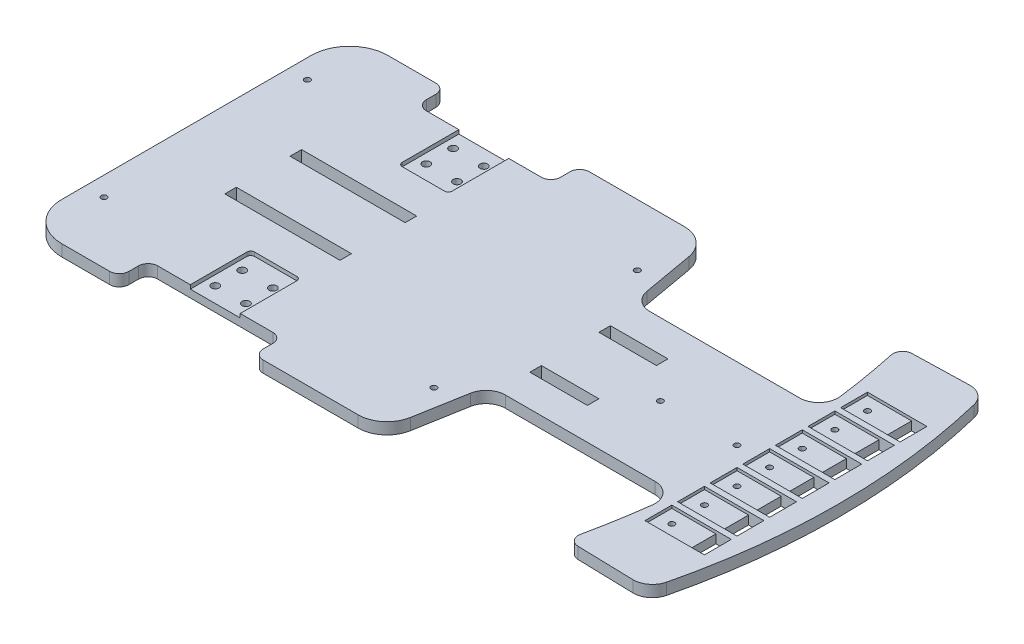
from build123d import *

# Parameters (mm, degrees)
BOSS_EXTRUDE1_DEPTH      = 5
BOSS_EXTRUDE1_DEPTH_BACK = 1
SKETCH1_R                = 2
SKETCH3_R                = 1.5
SKETCH3_W                = 8
SKETCH3_H                = 14
SKETCH3_W_2              = 60
SKETCH3_H_2              = 6
SKETCH3_W_3              = 30
CUT_EXTRUDE2_DEPTH       = 382.529815349
FILLET1_R                = 5
FILLET2_R                = 10
FILLET3_R                = 5
FILLET4_R                = 10
FILLET5_R                = 5
FILLET6_R                = 5
FILLET7_R                = 5
FILLET8_R                = 5
FILLET9_R                = 5
FILLET10_R               = 5
FILLET11_R               = 5
FILLET12_R               = 5
CUT_EXTRUDE3_DEPTH       = 2
SKETCH5_W                = 23
SKETCH5_H                = 14
CUT_EXTRUDE4_DEPTH       = 1.5


with BuildPart() as part:
    # Sketch1 → Boss-Extrude1 (new, two sides: drawn at the far end of the back side and taken through both)
    with BuildSketch(Plane(origin=(0, 0, 0), x_dir=(1, 0, 0), z_dir=(0, 1, 0)).offset(-BOSS_EXTRUDE1_DEPTH_BACK)):
        with BuildLine():
            ThreePointArc((0, 20), (5.857864376, 5.857864376), (20, 0))
            Line((20, 0), (50, 0))
            Line((50, 0), (50, 15))
            Line((50, 15), (120, 15))
            Line((120, 15), (120, 0))
            Line((120, 0), (174.516287626, 0))
            ThreePointArc((174.516287626, 0), (184.152968357, 3.50502786), (189.286071162, 12.382082068))
            Line((189.286071162, 12.382082068), (194.016707233, 39.071410209))
            ThreePointArc((194.016707233, 39.071410209), (197.438775769, 44.989446348), (203.86322959, 47.326131588))
            Line((203.86322959, 47.326131588), (275.479841954, 47.326131588))
            Line((275.479841954, 47.326131588), (281.957258661, 47.326131588))
            ThreePointArc((281.957258661, 47.326131588), (289.464356355, 43.932453122), (291.876118892, 36.05482843))
            ThreePointArc((291.876118892, 36.05482843), (289.726144633, 21.493661084), (287.021151563, 7.025316456))
            ThreePointArc((287.021151563, 7.025316456), (286.072411794, 2.570993654), (285.071048277, -1.871794872))
            Line((285.071048277, -1.871794872), (328.414372402, -3))
            ThreePointArc((328.414372402, -3), (329.306211212, 0.398467763), (330.162883312, 3.805970149))
            ThreePointArc((330.162883312, 3.805970149), (340, 85), (330.162883312, 166.194029851))
            ThreePointArc((330.162883312, 166.194029851), (329.306211212, 169.601532237), (328.414372402, 173))
            Line((328.414372402, 173), (285.071048277, 171.871794872))
            ThreePointArc((285.071048277, 171.871794872), (286.072411794, 167.429006346), (287.021151563, 162.974683544))
            ThreePointArc((287.021151563, 162.974683544), (289.726144633, 148.506338916), (291.876118892, 133.94517157))
            ThreePointArc((291.876118892, 133.94517157), (289.464356355, 126.067546878), (281.957258661, 122.673868412))
            Line((281.957258661, 122.673868412), (275.479841954, 122.673868412))
            Line((275.479841954, 122.673868412), (203.86322959, 122.673868412))
            ThreePointArc((203.86322959, 122.673868412), (197.438775769, 125.010553652), (194.016707233, 130.928589791))
            Line((194.016707233, 130.928589791), (189.286071162, 157.617917932))
            ThreePointArc((189.286071162, 157.617917932), (184.152968357, 166.49497214), (174.516287626, 170))
            Line((174.516287626, 170), (120, 170))
            Line((120, 170), (120, 155))
            Line((120, 155), (50, 155))
            Line((50, 155), (50, 170))
            Line((50, 170), (20, 170))
            ThreePointArc((20, 170), (5.857864376, 164.142135624), (0, 150))
            Line((0, 150), (0, 85))
            Line((0, 85), (0, 20))
        make_face()
        with Locations(Location((77, 23, 0), (0, 0, 270))):
            Circle(SKETCH1_R, mode=Mode.SUBTRACT)
        with Locations(Location((77, 37, 0), (0, 0, 270))):
            Circle(SKETCH1_R, mode=Mode.SUBTRACT)
        with Locations(Location((93, 23, 0), (0, 0, 270))):
            Circle(SKETCH1_R, mode=Mode.SUBTRACT)
        with Locations(Location((93, 37, 0), (0, 0, 270))):
            Circle(SKETCH1_R, mode=Mode.SUBTRACT)
        with Locations(Location((77, 133, 0), (0, 0, 270))):
            Circle(SKETCH1_R, mode=Mode.SUBTRACT)
        with Locations(Location((77, 147, 0), (0, 0, 270))):
            Circle(SKETCH1_R, mode=Mode.SUBTRACT)
        with Locations(Location((93, 133, 0), (0, 0, 270))):
            Circle(SKETCH1_R, mode=Mode.SUBTRACT)
        with Locations(Location((93, 147, 0), (0, 0, 270))):
            Circle(SKETCH1_R, mode=Mode.SUBTRACT)
    extrude(amount=BOSS_EXTRUDE1_DEPTH + BOSS_EXTRUDE1_DEPTH_BACK)

    # Sketch3 → Cut-Extrude2 (cut, through all)
    with BuildSketch(Plane(origin=(0, 5, 0), x_dir=(1, 0, 0), z_dir=(0, 1, 0))):
        with Locations(Location((304, 34, 0), (0, 0, 270))):
            Circle(SKETCH3_R)
        with Locations(Location((304, 51, 0), (0, 0, 270))):
            Circle(SKETCH3_R)
        with Locations((324, 51)):
            Rectangle(SKETCH3_W, SKETCH3_H)
        with Locations((324, 34)):
            Rectangle(SKETCH3_W, SKETCH3_H)
        with Locations(Location((304, 68, 0), (0, 0, 270))):
            Circle(SKETCH3_R)
        with Locations(Location((304, 85, 0), (0, 0, 270))):
            Circle(SKETCH3_R)
        with Locations(Location((304, 102, 0), (0, 0, 270))):
            Circle(SKETCH3_R)
        with Locations((324, 102)):
            Rectangle(SKETCH3_W, SKETCH3_H)
        with Locations((324, 119)):
            Rectangle(SKETCH3_W, SKETCH3_H)
        with Locations((324, 85)):
            Rectangle(SKETCH3_W, SKETCH3_H)
        with Locations((324, 68)):
            Rectangle(SKETCH3_W, SKETCH3_H)
        with Locations((324, 136)):
            Rectangle(SKETCH3_W, SKETCH3_H)
        with Locations(Location((304, 136, 0), (0, 0, 270))):
            Circle(SKETCH3_R)
        with Locations(Location((304, 119, 0), (0, 0, 270))):
            Circle(SKETCH3_R)
        with Locations(Location((247, 85, 0), (0, 0, 270))):
            Circle(SKETCH3_R)
        with Locations(Location((287, 85, 0), (0, 0, 270))):
            Circle(SKETCH3_R)
        with Locations((70, 68)):
            Rectangle(SKETCH3_W_2, SKETCH3_H_2)
        with Locations((70, 102)):
            Rectangle(SKETCH3_W_2, SKETCH3_H_2)
        with Locations((215, 103)):
            Rectangle(SKETCH3_W_3, SKETCH3_H_2)
        with Locations((215, 67)):
            Rectangle(SKETCH3_W_3, SKETCH3_H_2)
        with Locations(Location((10, 138, 0), (0, 0, 270))):
            Circle(SKETCH3_R)
        with Locations(Location((10, 32, 0), (0, 0, 270))):
            Circle(SKETCH3_R)
        with Locations(Location((182, 138, 0), (0, 0, 270))):
            Circle(SKETCH3_R)
        with Locations(Location((182, 32, 0), (0, 0, 270))):
            Circle(SKETCH3_R)
    extrude(amount=-CUT_EXTRUDE2_DEPTH, mode=Mode.SUBTRACT)

    # Fillet1
    fillet1_edges = [part.edges().sort_by_distance(p)[0] for p in [
        (285.071048277, 2, -171.871794872),
    ]]
    fillet(fillet1_edges, radius=FILLET1_R)

    # Fillet2
    fillet2_edges = [part.edges().sort_by_distance(p)[0] for p in [
        (328.414372402, 2.5, -173),
    ]]
    fillet(fillet2_edges, radius=FILLET2_R)

    # Fillet3
    fillet3_edges = [part.edges().sort_by_distance(p)[0] for p in [
        (285.071048277, 2, 1.871794872),
    ]]
    fillet(fillet3_edges, radius=FILLET3_R)

    # Fillet4
    fillet4_edges = [part.edges().sort_by_distance(p)[0] for p in [
        (328.414372402, 2.5, 3),
    ]]
    fillet(fillet4_edges, radius=FILLET4_R)

    # Fillet5
    fillet5_edges = [part.edges().sort_by_distance(p)[0] for p in [
        (50, 2, -15),
    ]]
    fillet(fillet5_edges, radius=FILLET5_R)

    # Fillet6
    fillet6_edges = [part.edges().sort_by_distance(p)[0] for p in [
        (120, 2, -15),
    ]]
    fillet(fillet6_edges, radius=FILLET6_R)

    # Fillet7
    fillet7_edges = [part.edges().sort_by_distance(p)[0] for p in [
        (120, 2, -155),
    ]]
    fillet(fillet7_edges, radius=FILLET7_R)

    # Fillet8
    fillet8_edges = [part.edges().sort_by_distance(p)[0] for p in [
        (50, 2, -155),
    ]]
    fillet(fillet8_edges, radius=FILLET8_R)

    # Fillet9
    fillet9_edges = [part.edges().sort_by_distance(p)[0] for p in [
        (50, 2, -170),
    ]]
    fillet(fillet9_edges, radius=FILLET9_R)

    # Fillet10
    fillet10_edges = [part.edges().sort_by_distance(p)[0] for p in [
        (120, 2, -170),
    ]]
    fillet(fillet10_edges, radius=FILLET10_R)

    # Fillet11
    fillet11_edges = [part.edges().sort_by_distance(p)[0] for p in [
        (50, 2, 0),
    ]]
    fillet(fillet11_edges, radius=FILLET11_R)

    # Fillet12
    fillet12_edges = [part.edges().sort_by_distance(p)[0] for p in [
        (120, 2, 0),
    ]]
    fillet(fillet12_edges, radius=FILLET12_R)

    # Sketch4 → Cut-Extrude3 (cut)
    with BuildSketch(Plane(origin=(0, 5, 0), x_dir=(1, 0, 0), z_dir=(0, 1, 0))):
        with BuildLine():
            Line((74, 46.5), (96, 46.5))
            ThreePointArc((96, 46.5), (97.414213562, 45.914213562), (98, 44.5))
            Line((98, 44.5), (98, 15))
            Line((98, 15), (72, 15))
            Line((72, 15), (72, 44.5))
            ThreePointArc((72, 44.5), (72.585786438, 45.914213562), (74, 46.5))
        make_face()
        with BuildLine():
            Line((72, 155), (98, 155))
            Line((98, 155), (98, 125.5))
            ThreePointArc((98, 125.5), (97.414213562, 124.085786438), (96, 123.5))
            Line((96, 123.5), (74, 123.5))
            ThreePointArc((74, 123.5), (72.585786438, 124.085786438), (72, 125.5))
            Line((72, 125.5), (72, 155))
        make_face()
    extrude(amount=-CUT_EXTRUDE3_DEPTH, mode=Mode.SUBTRACT)

    # Sketch5 → Cut-Extrude4 (cut)
    with BuildSketch(Plane(origin=(0, 5, 0), x_dir=(1, 0, 0), z_dir=(0, 1, 0))):
        with Locations((308.5, 51)):
            Rectangle(SKETCH5_W, SKETCH5_H)
        with Locations((308.5, 34)):
            Rectangle(SKETCH5_W, SKETCH5_H)
        with Locations((308.5, 68)):
            Rectangle(SKETCH5_W, SKETCH5_H)
        with Locations((308.5, 85)):
            Rectangle(SKETCH5_W, SKETCH5_H)
        with Locations((308.5, 102)):
            Rectangle(SKETCH5_W, SKETCH5_H)
        with Locations((308.5, 119)):
            Rectangle(SKETCH5_W, SKETCH5_H)
        with Locations((308.5, 136)):
            Rectangle(SKETCH5_W, SKETCH5_H)
    extrude(amount=-CUT_EXTRUDE4_DEPTH, mode=Mode.SUBTRACT)


solid = part.part
